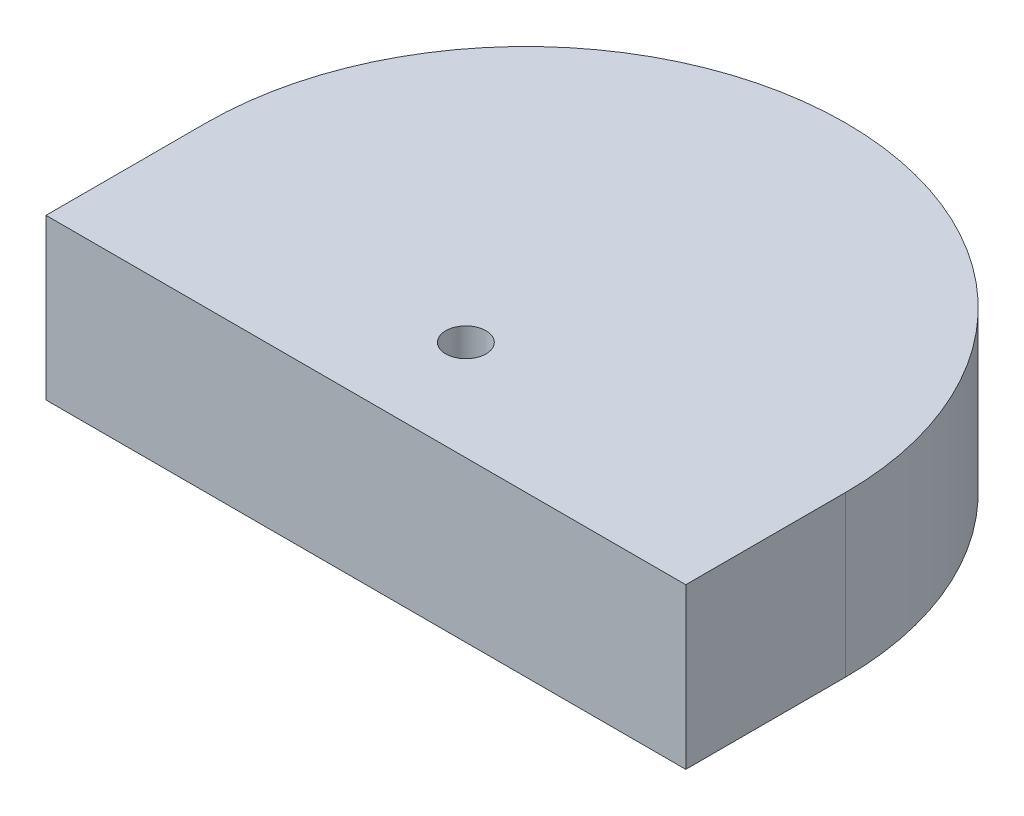
from build123d import *

# Parameters (mm, degrees)
BOSS_EXTRUDE1_DEPTH = 20
SKETCH3_W           = 80
SKETCH3_H           = 15
BOSS_EXTRUDE3_DEPTH = 20
SKETCH4_R           = 1.75
CUT_EXTRUDE1_DEPTH  = 20
SKETCH6_W           = 80
SKETCH6_H           = 5
BOSS_EXTRUDE4_DEPTH = 20
SKETCH7_R           = 2.518213347
CUT_EXTRUDE3_DEPTH  = 20


with BuildPart() as part:
    # Sketch1 → Boss-Extrude1 (new body)
    with BuildSketch(Plane(origin=(0, 0, 0), x_dir=(1, 0, 0), z_dir=(0, 1, 0))):
        with BuildLine():
            Line((-40, 0), (40, 0))
            ThreePointArc((40, 0), (0, 40), (-40, 0))
        make_face()
    extrude(amount=BOSS_EXTRUDE1_DEPTH)

    # Sketch3 → Boss-Extrude3 (add)
    with BuildSketch(Plane(origin=(0, 20, 0), x_dir=(1, 0, 0), z_dir=(0, 1, 0))):
        with Locations((0, -7.5)):
            Rectangle(SKETCH3_W, SKETCH3_H)
    extrude(amount=-BOSS_EXTRUDE3_DEPTH)

    # Sketch4 → Cut-Extrude1 (cut)
    with BuildSketch(Plane(origin=(0, 0, 0), x_dir=(-1, 0, 0), z_dir=(0, -1, 0))):
        with Locations(Location((0, -7.5, 0), (0, 0, 90))):
            Circle(SKETCH4_R)
    extrude(amount=-CUT_EXTRUDE1_DEPTH, mode=Mode.SUBTRACT)

    # Sketch6 → Boss-Extrude4 (add)
    with BuildSketch(Plane(origin=(0, 0, 0), x_dir=(-1, 0, 0), z_dir=(0, -1, 0))):
        with Locations((0, -17.5)):
            Rectangle(SKETCH6_W, SKETCH6_H)
    extrude(amount=-BOSS_EXTRUDE4_DEPTH)

    # Sketch7 → Cut-Extrude3 (cut)
    with BuildSketch(Plane(origin=(0, 20, 0), x_dir=(1, 0, 0), z_dir=(0, 1, 0))):
        with Locations(Location((0, -7.5, 0), (0, 0, 270))):
            Circle(SKETCH7_R)
    extrude(amount=-CUT_EXTRUDE3_DEPTH, mode=Mode.SUBTRACT)


solid = part.part
